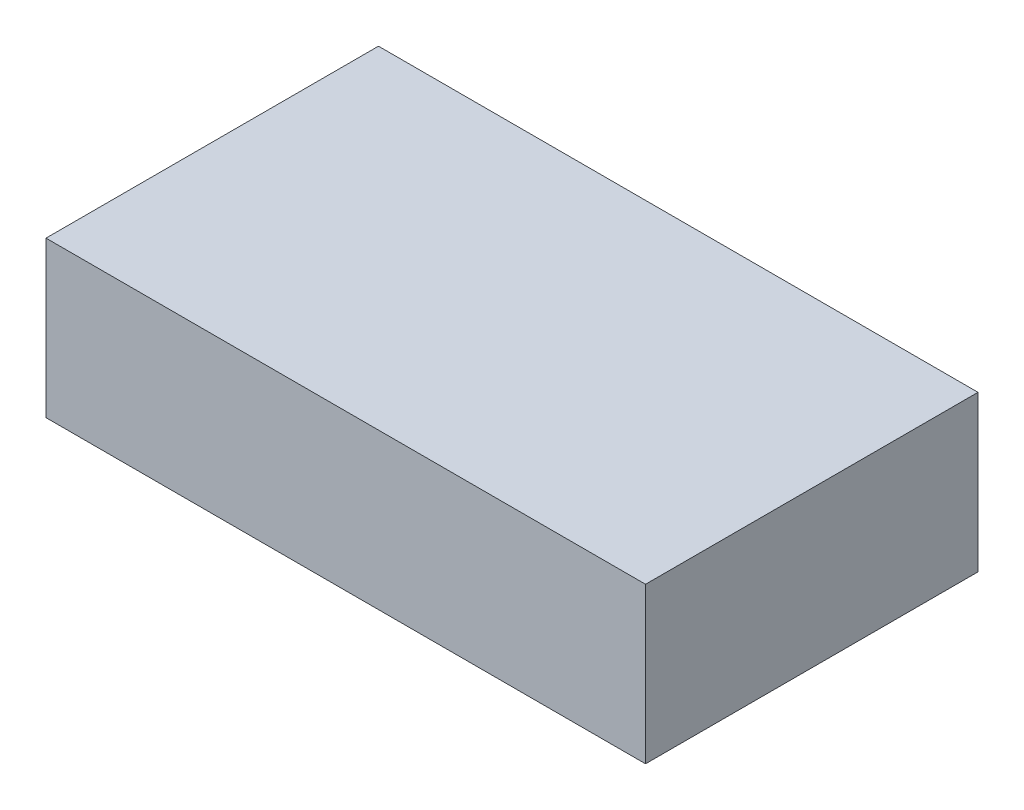
from build123d import *

# Parameters (mm, degrees)
SKETCH1_W           = 137.407001984
SKETCH1_H           = 35.641957088
BOSS_EXTRUDE1_DEPTH = 76.2


with BuildPart() as part:
    # Sketch1 → Boss-Extrude1 (new body)
    with BuildSketch(Plane.XY):
        Rectangle(SKETCH1_W, SKETCH1_H)
    extrude(amount=BOSS_EXTRUDE1_DEPTH)


solid = part.part
